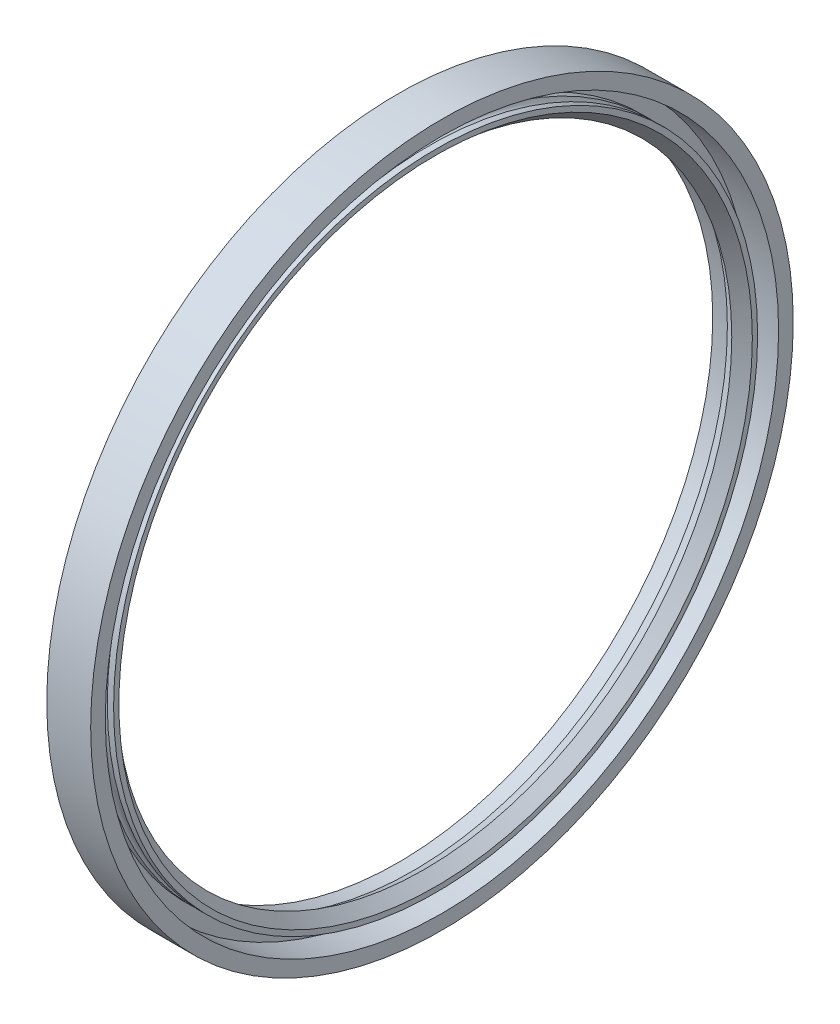
from build123d import *


with BuildPart() as part:
    # Sketch1 → Revolve1 (revolve)
    with BuildSketch(Plane.XY):
        with BuildLine():
            Line((15, 120), (0, 120))
            Line((0, 120), (0, 107.5))
            Line((0, 107.5), (5, 107.5))
            Line((5, 107.5), (9, 105))
            Line((9, 105), (12.8333335, 108.194444583))
            Line((12.8333335, 108.194444583), (12.8333335, 110))
            Line((12.8333335, 110), (10.666667, 110))
            ThreePointArc((10.666667, 110), (9, 108.333333), (7.333333, 110))
            Line((7.333333, 110), (5, 110))
            Line((5, 110), (5, 115))
            Line((5, 115), (15, 115))
            Line((15, 115), (15, 120))
        make_face()
    revolve(axis=Axis((-0.005, 0, 0), (1, 0, 0)))


solid = part.part
